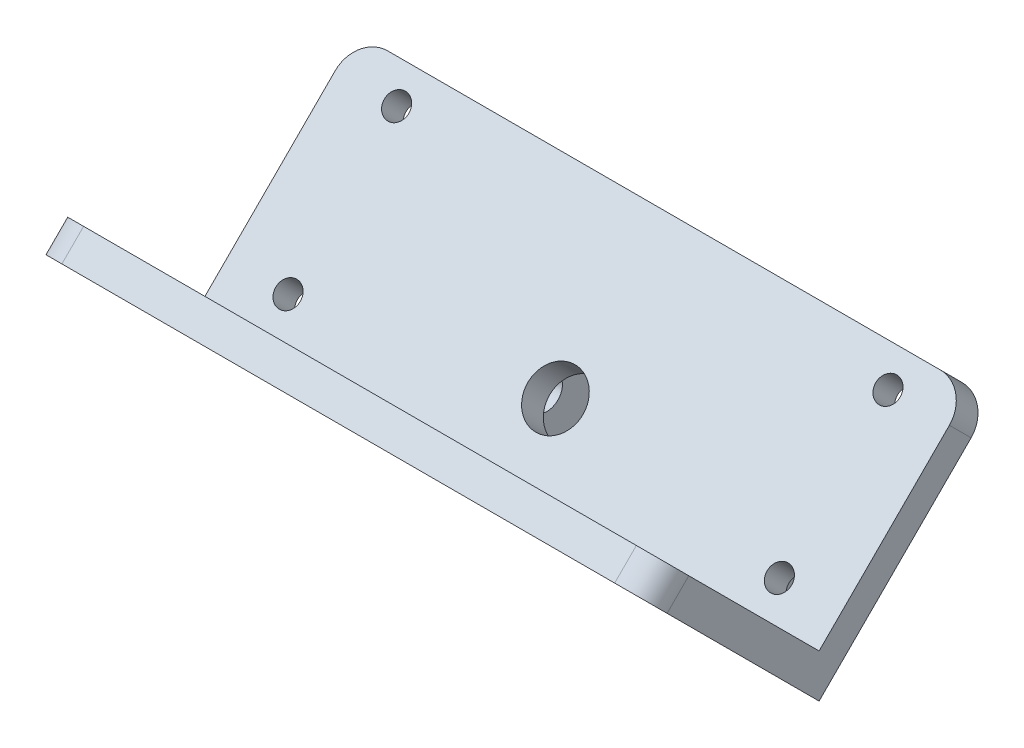
from build123d import *

# Parameters (mm, degrees)
BOSS_EXTRUDE1_DEPTH  = 50
M8_CLEARANCE_HOLE1_D = 9
SKETCH7_W            = 5
SKETCH7_H            = 30
BOSS_EXTRUDE4_DEPTH  = 30
SKETCH9_R            = 2.5
CUT_EXTRUDE1_DEPTH   = 88.007183611
SKETCH11_R           = 2
CUT_EXTRUDE2_DEPTH   = 72.414284285
BOSS_EXTRUDE7_DEPTH  = 5
FILLET4_R            = 5


with BuildPart() as part:
    # Sketch2 → Boss-Extrude1 (new, symmetric)
    with BuildSketch(Plane(origin=(0, 0, 0), x_dir=(0, 0, -1), z_dir=(1, 0, 0))):
        Polygon((0, 0), (-24.748737342, 24.748737342), (-28.284271247, 21.213203436), (0, -7.071067812), (28.284271247, 21.213203436), (24.748737342, 24.748737342), align=None)
    extrude(amount=BOSS_EXTRUDE1_DEPTH, both=True)

    # M8 Clearance Hole1 (through all)
    with Locations(Plane(origin=(0, 0, 0), x_dir=(1, 0, 0), z_dir=(0, 0.7071067811865489, 0.7071067811865461))):
        with Locations((0, 10)):
            Hole(M8_CLEARANCE_HOLE1_D / 2)

    # Sketch7 → Boss-Extrude4 (add)
    with BuildSketch(Plane(origin=(0, -3.535533906, -3.535533906), x_dir=(1, 0, 0), z_dir=(0, -0.7071067811865479, -0.7071067811865471))):
        with Locations((18, -10)):
            Rectangle(SKETCH7_W, SKETCH7_H)
        with Locations((-18, -10)):
            Rectangle(SKETCH7_W, SKETCH7_H)
    extrude(amount=BOSS_EXTRUDE4_DEPTH)

    # Sketch9 → Cut-Extrude1 (cut, through all)
    with BuildSketch(Plane(origin=(20.5, 0, 0), x_dir=(0, 0, -1), z_dir=(1, 0, 0))):
        with Locations((21.213203436, -7.071067812)):
            Circle(SKETCH9_R)
    extrude(amount=-CUT_EXTRUDE1_DEPTH, mode=Mode.SUBTRACT)

    # Sketch11 → Cut-Extrude2 (cut, through all)
    with BuildSketch(Plane(origin=(0, 0, 0), x_dir=(1, 0, 0), z_dir=(0, 0.7071067811865477, 0.7071067811865474))):
        with Locations((-40, 30)):
            Circle(SKETCH11_R)
        with Locations((-40, 5)):
            Circle(SKETCH11_R)
        with Locations((40, 30)):
            Circle(SKETCH11_R)
        with Locations((40, 5)):
            Circle(SKETCH11_R)
    cut_extrude2 = extrude(amount=-CUT_EXTRUDE2_DEPTH, mode=Mode.SUBTRACT)

    # Mirror1: Cut-Extrude2 across plane
    add(cut_extrude2.mirror(Plane.XY), mode=Mode.SUBTRACT)

    # Sketch12 → Boss-Extrude7 (add)
    with BuildSketch(Plane(origin=(0, -3.535533906, 3.535533906), x_dir=(1, 0, 0), z_dir=(0, 0.7071067811865475, -0.7071067811865477))):
        Polygon((-50, 5), (-20.5, 35), (-20.5, 5), align=None)
        Polygon((20.5, 5), (20.5, 35), (50, 5), align=None)
    extrude(amount=BOSS_EXTRUDE7_DEPTH)

    # Fillet4
    fillet4_edges = [part.edges().sort_by_distance(p)[0] for p in [
        (18, -7.071067812, -42.426406871),
        (-18, -7.071067812, -42.426406871),
        (-50, 22.980970389, -26.516504294),
        (-50, 22.980970389, 26.516504294),
        (50, 22.980970389, -26.516504294),
        (50, 22.980970389, 26.516504294),
    ]]
    fillet(fillet4_edges, radius=FILLET4_R)


solid = part.part
